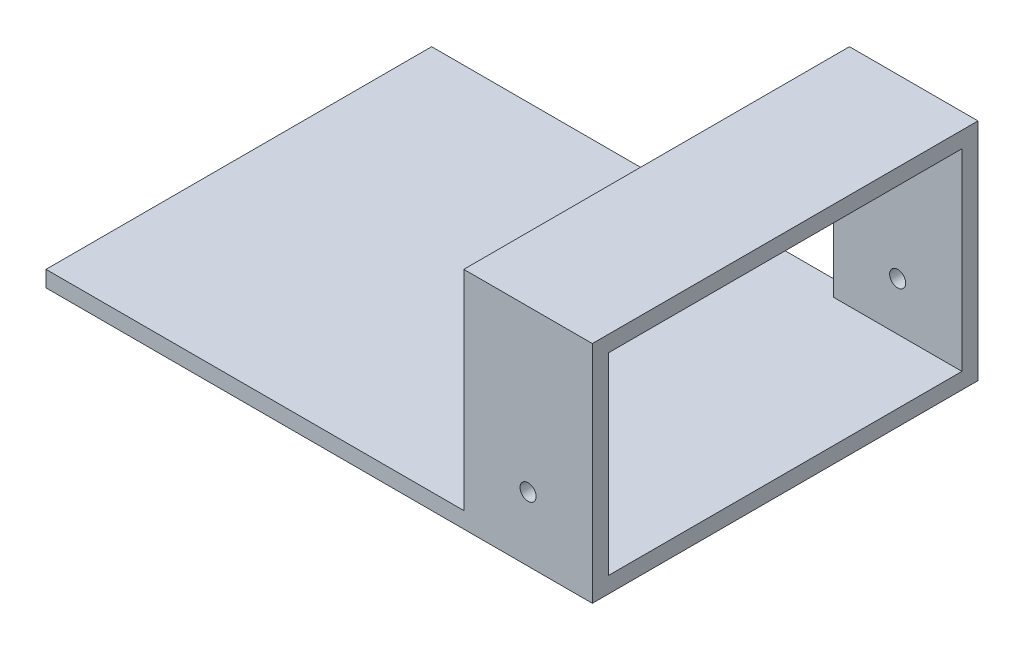
from build123d import *

# Parameters (mm, degrees)
SKETCH1_W                   = 165.1
SKETCH1_H                   = 152.4
BOSS_EXTRUDE1_DEPTH         = 6.35
SKETCH1_7_W                 = 50.8
SKETCH1_7_H                 = 152.4
BOSS_EXTRUDE2_DEPTH         = 88.9
SKETCH29_W                  = 139.7
SKETCH29_H                  = 76.2
CUT_EXTRUDE4_DEPTH          = 242.633979399
F_1_4_0_25_DIAMETER_HOLE2_D = 6.35


with BuildPart() as part:
    # Sketch1 → Boss-Extrude1 (new body)
    with BuildSketch(Plane(origin=(0, 0, 0), x_dir=(1, 0, 0), z_dir=(0, 1, 0))):
        with Locations((-133.35, 76.2)):
            Rectangle(SKETCH1_W, SKETCH1_H)
    extrude(amount=BOSS_EXTRUDE1_DEPTH)

    # Sketch1<7> → Boss-Extrude2 (add)
    with BuildSketch(Plane(origin=(0, 0, 0), x_dir=(1, 0, 0), z_dir=(0, 1, 0))):
        with Locations((-25.4, 76.2)):
            Rectangle(SKETCH1_7_W, SKETCH1_7_H)
    extrude(amount=BOSS_EXTRUDE2_DEPTH)

    # Sketch29 → Cut-Extrude4 (cut, through all)
    with BuildSketch(Plane.ZY.offset(50.8)):
        with Locations((-76.2, 44.45)):
            Rectangle(SKETCH29_W, SKETCH29_H)
    extrude(amount=-CUT_EXTRUDE4_DEPTH, mode=Mode.SUBTRACT)

    # 1/4 (0.25) Diameter Hole2 (through all)
    with Locations(Plane(origin=(0, 0, -152.4), x_dir=(-1, 0, 0), z_dir=(0, 0, -1))):
        with Locations((25.4, 25.4)):
            Hole(F_1_4_0_25_DIAMETER_HOLE2_D / 2)


solid = part.part
